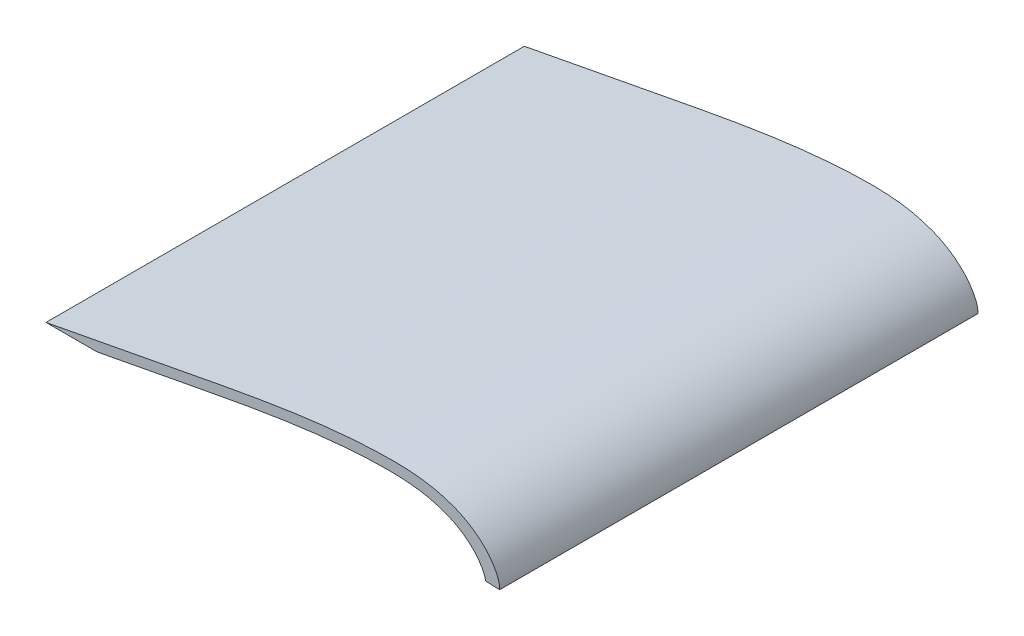
from build123d import *

# Parameters (mm, degrees)
BOSS_EXTRUDE1_DEPTH             = 50
BOSS_EXTRUDE2_REACH             = 72.874
SKETCH4_R                       = 4.9
BOSS_EXTRUDE2_DIRECTION_2_DEPTH = 0.46


with BuildPart() as part:
    # Sketch3 → Boss-Extrude1 (new, symmetric)
    with BuildSketch(Plane.XY):
        with BuildLine():
            Line((-46.126968972, 0.978621832), (-35.415500388, 0.978621832))
            add(Edge.make_bspline(
                [(-35.415500388, 0.978621832), (-31.900717337, 1.646356284), (-28.385669806, 2.312644878), (-21.356250818, 3.648918025), (-17.842575491, 4.322708179), (-10.812262333, 5.654093081), (-7.296066509, 6.314104196), (-0.246237667, 7.538800854), (3.289652388, 8.100927369), (10.382593906, 9.05560756), (13.939655637, 9.449931283), (19.294779383, 9.845985299), (21.080534176, 9.94564859), (24.654054204, 10.053814529), (26.441812496, 10.062631968), (29.126639881, 9.931214403), (30.021142665, 9.862531806), (31.793464098, 9.656084843), (32.672832664, 9.517565102), (34.414963225, 9.15422751), (35.277930032, 8.930473985), (36.558652221, 8.523504326), (36.984484861, 8.375558226), (37.823491014, 8.056379668), (38.649942038, 7.713371742), (39.445605832, 7.311930302), (40.222624744, 6.875101272), (40.601901137, 6.639162596), (41.343034868, 6.13422425), (41.706577137, 5.864403259), (42.405097582, 5.299009429), (42.740435419, 5.002707871), (43.379039637, 4.378765248), (43.682854505, 4.051660151), (44.248370211, 3.356297071), (44.509109318, 2.983679064), (44.864883627, 2.405343349), (44.977987263, 2.209593987), (45.193994648, 1.812573614), (45.296445183, 1.611057258), (45.481130702, 1.197080973), (45.56357233, 0.983774864), (45.690582147, 0.549932416), (45.735539216, 0.328490722), (45.752720851, 0.100279614)],
                knots=[0, 0, 0, 0, 0.125, 0.125, 0.25, 0.25, 0.375, 0.375, 0.5, 0.5, 0.625, 0.625, 0.6875, 0.6875, 0.75, 0.75, 0.78125, 0.78125, 0.8125, 0.8125, 0.84375, 0.84375, 0.859375, 0.859375, 0.875, 0.890625, 0.890625, 0.90625, 0.90625, 0.921875, 0.921875, 0.9375, 0.9375, 0.953125, 0.953125, 0.96875, 0.96875, 0.9765625, 0.9765625, 0.984375, 0.984375, 0.9921875, 0.9921875, 1, 1, 1, 1], degree=3))
            Line((45.752720851, 0.100279614), (48.72072986, 0))
            add(Edge.make_bspline(
                [(48.72072986, 0), (48.741252965, 1.211959263), (48.046357201, 2.857215342), (46.815105861, 4.78389108), (45.492517633, 6.302382051), (43.826843254, 7.740810658), (41.494622603, 9.264300756), (38.168076465, 10.717178582), (33.78869279, 11.831530653), (28.729432589, 12.255898832), (23.71704668, 12.218808276), (17.039017695, 11.857586647), (8.690276234, 10.974271434), (-1.304085126, 9.447886993), (-11.287660735, 7.611152922), (-21.278620725, 5.696721586), (-32.895483349, 3.494457071), (-41.17773966, 1.91909956), (-46.126968972, 0.978621832)],
                knots=[0, 0, 0, 0, 0.032626759, 0.049882871, 0.06427589, 0.089250813, 0.111667998, 0.142584384, 0.191135501, 0.238340392, 0.285329255, 0.332381604, 0.426846937, 0.521876031, 0.61736406, 0.713023045, 0.80868203, 0.950714186, 0.950714186, 0.950714186, 0.950714186], degree=3))
        make_face()
    extrude(amount=BOSS_EXTRUDE1_DEPTH, both=True)

    # Sketch4 → Boss-Extrude2 (add, up to next)
    with BuildSketch(Plane(origin=(0, 0, 0), x_dir=(1, 0, 0), z_dir=(0, 1, 0)), mode=Mode.PRIVATE) as boss_extrude2_sk1:
        with Locations((-13.27927014, 0)):
            Circle(SKETCH4_R)
    boss_extrude2_tool1 = extrude(boss_extrude2_sk1.sketch, amount=BOSS_EXTRUDE2_REACH, mode=Mode.PRIVATE) - part.part
    add(boss_extrude2_tool1.solids().sort_by_distance((-13.27927, 0, 0))[0])

    # Sketch4 → Boss-Extrude2 direction 2 (add)
    with BuildSketch(Plane(origin=(0, 0, 0), x_dir=(1, 0, 0), z_dir=(0, 1, 0))):
        with Locations((-13.27927014, 0)):
            Circle(SKETCH4_R)
    extrude(amount=-BOSS_EXTRUDE2_DIRECTION_2_DEPTH)


solid = part.part
